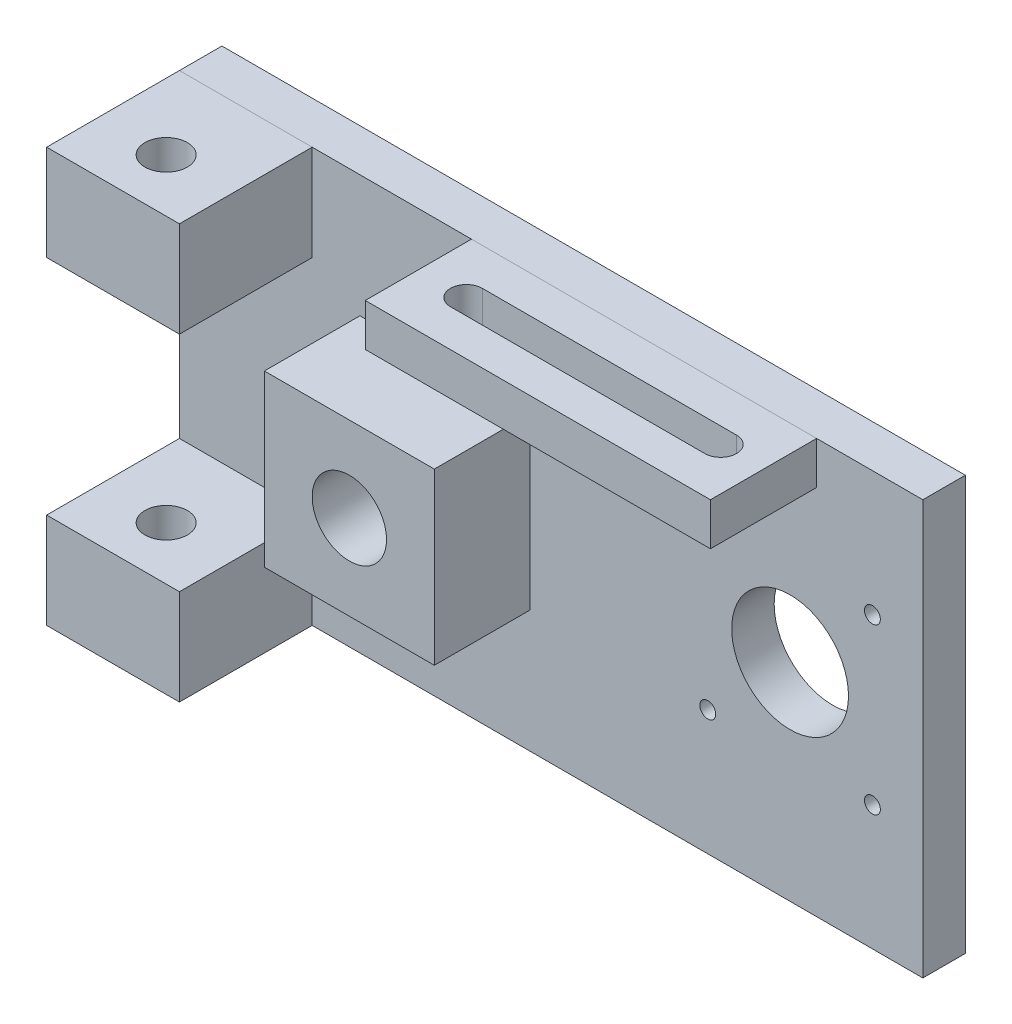
from build123d import *

# Parameters (mm, degrees)
SKETCH1_W             = 140
SKETCH1_H             = 78
BOSS_EXTRUDE1_DEPTH   = 8
CUT_EXTRUDE1_REACH    = 82.529
SKETCH2_R             = 1.5
SKETCH2_R_2           = 11
SKETCH3_W             = 25
SKETCH3_H             = 18
BOSS_EXTRUDE2_DEPTH   = 25
BOSS_EXTRUDE2_2_DEPTH = 25
SKETCH4_R             = 4
CUT_EXTRUDE2_DEPTH    = 110.877204187
BOSS_EXTRUDE4_START   = 8
SKETCH7_W             = 32
SKETCH7_H             = 32
SKETCH7_R             = 11
BOSS_EXTRUDE4_DEPTH   = 8
SKETCH8_W             = 32
SKETCH8_H             = 32
SKETCH8_R             = 7
BOSS_EXTRUDE5_DEPTH   = 10
SKETCH9_W             = 65
SKETCH9_H             = 8
BOSS_EXTRUDE6_DEPTH   = 20
SKETCH11_R            = 3
CUT_EXTRUDE3_DEPTH    = 8


with BuildPart() as part:
    # Sketch1 → Boss-Extrude1 (new body)
    with BuildSketch(Plane.XY):
        Rectangle(SKETCH1_W, SKETCH1_H)
    extrude(amount=BOSS_EXTRUDE1_DEPTH)

    # Sketch2 → Cut-Extrude1 (cut, up to next)
    with BuildSketch(Plane.XY.offset(8), mode=Mode.PRIVATE) as cut_extrude1_sk1:
        with Locations((29.5, 15.5)):
            Circle(SKETCH2_R)
    cut_extrude1_tool1 = extrude(cut_extrude1_sk1.sketch, amount=-CUT_EXTRUDE1_REACH, mode=Mode.PRIVATE) & part.part
    # Sketch2 → Cut-Extrude1 (cut, up to next)
    with BuildSketch(Plane.XY.offset(8), mode=Mode.PRIVATE) as cut_extrude1_sk2:
        with Locations((60.5, 15.5)):
            Circle(SKETCH2_R)
    cut_extrude1_tool2 = extrude(cut_extrude1_sk2.sketch, amount=-CUT_EXTRUDE1_REACH, mode=Mode.PRIVATE) & part.part
    # Sketch2 → Cut-Extrude1 (cut, up to next)
    with BuildSketch(Plane.XY.offset(8), mode=Mode.PRIVATE) as cut_extrude1_sk3:
        with Locations((60.5, -15.5)):
            Circle(SKETCH2_R)
    cut_extrude1_tool3 = extrude(cut_extrude1_sk3.sketch, amount=-CUT_EXTRUDE1_REACH, mode=Mode.PRIVATE) & part.part
    # Sketch2 → Cut-Extrude1 (cut, up to next)
    with BuildSketch(Plane.XY.offset(8), mode=Mode.PRIVATE) as cut_extrude1_sk4:
        with Locations((29.5, -15.5)):
            Circle(SKETCH2_R)
    cut_extrude1_tool4 = extrude(cut_extrude1_sk4.sketch, amount=-CUT_EXTRUDE1_REACH, mode=Mode.PRIVATE) & part.part
    # Sketch2 → Cut-Extrude1 (cut, up to next)
    with BuildSketch(Plane.XY.offset(8), mode=Mode.PRIVATE) as cut_extrude1_sk5:
        with Locations((-20, 0)):
            Circle(SKETCH2_R_2)
    cut_extrude1_tool5 = extrude(cut_extrude1_sk5.sketch, amount=-CUT_EXTRUDE1_REACH, mode=Mode.PRIVATE) & part.part
    # Sketch2 → Cut-Extrude1 (cut, up to next)
    with BuildSketch(Plane.XY.offset(8), mode=Mode.PRIVATE) as cut_extrude1_sk6:
        with Locations((45, 0)):
            Circle(SKETCH2_R_2)
    cut_extrude1_tool6 = extrude(cut_extrude1_sk6.sketch, amount=-CUT_EXTRUDE1_REACH, mode=Mode.PRIVATE) & part.part
    add(cut_extrude1_tool1.solids().sort_by_distance((29.5, 15.5, 8))[0], mode=Mode.SUBTRACT)
    add(cut_extrude1_tool2.solids().sort_by_distance((60.5, 15.5, 8))[0], mode=Mode.SUBTRACT)
    add(cut_extrude1_tool3.solids().sort_by_distance((60.5, -15.5, 8))[0], mode=Mode.SUBTRACT)
    add(cut_extrude1_tool4.solids().sort_by_distance((29.5, -15.5, 8))[0], mode=Mode.SUBTRACT)
    add(cut_extrude1_tool5.solids().sort_by_distance((-20, 0, 8))[0], mode=Mode.SUBTRACT)
    add(cut_extrude1_tool6.solids().sort_by_distance((45, 0, 8))[0], mode=Mode.SUBTRACT)

    # Sketch7 → Boss-Extrude4 (add)
    with BuildSketch(Plane.XY.offset(8).offset(BOSS_EXTRUDE4_START)):
        with Locations((-20, 0)):
            Rectangle(SKETCH7_W, SKETCH7_H)
        with Locations((-20, 0)):
            Circle(SKETCH7_R, mode=Mode.SUBTRACT)
    extrude(amount=-BOSS_EXTRUDE4_DEPTH)

    # Sketch8 → Boss-Extrude5 (add)
    with BuildSketch(Plane.XY.offset(16)):
        with Locations((-20, 0)):
            Rectangle(SKETCH8_W, SKETCH8_H)
        with Locations((-20, 0)):
            Circle(SKETCH8_R, mode=Mode.SUBTRACT)
    extrude(amount=BOSS_EXTRUDE5_DEPTH)


with BuildPart() as body_2:
    # Sketch3 → Boss-Extrude2 (new body)
    with BuildSketch(Plane.XY.offset(8)):
        with Locations((-57.5, 30)):
            Rectangle(SKETCH3_W, SKETCH3_H)
    extrude(amount=BOSS_EXTRUDE2_DEPTH)


with BuildPart() as body_3:
    # Sketch3 → Boss-Extrude2 2 (new body)
    with BuildSketch(Plane.XY.offset(8)):
        with Locations((-57.5, -30)):
            Rectangle(SKETCH3_W, SKETCH3_H)
    extrude(amount=BOSS_EXTRUDE2_2_DEPTH)


with BuildPart() as cut_extrude2_tool:
    # Sketch4 → Cut-Extrude2 (new, through all)
    with BuildSketch(Plane(origin=(0, 39, 0), x_dir=(1, 0, 0), z_dir=(0, 1, 0))):
        with Locations(Location((-57.5, -23, 0), (0, 0, 270))):
            Circle(SKETCH4_R)
    extrude(amount=-CUT_EXTRUDE2_DEPTH)


with BuildPart() as body_2_1:
    add(body_2.part)

    # Cut-Extrude2: cut by cut_extrude2_tool
    add(cut_extrude2_tool.part, mode=Mode.SUBTRACT)


with BuildPart() as body_3_1:
    add(body_3.part)

    # Cut-Extrude2: cut by cut_extrude2_tool
    add(cut_extrude2_tool.part, mode=Mode.SUBTRACT)


with BuildPart() as body_4:
    # Sketch9 → Boss-Extrude6 (new body)
    with BuildSketch(Plane.XY.offset(8)):
        with Locations((17.5, 35)):
            Rectangle(SKETCH9_W, SKETCH9_H)
    extrude(amount=BOSS_EXTRUDE6_DEPTH)

    # Sketch11 → Cut-Extrude3 (cut)
    with BuildSketch(Plane(origin=(0, 39, 0), x_dir=(1, 0, 0), z_dir=(0, 1, 0))):
        with Locations((-5.960232812, -18)):
            Circle(SKETCH11_R)
        with BuildLine():
            Line((41.923671474, -15), (-5.960232812, -15))
            ThreePointArc((-5.960232812, -15), (-3.838912468, -15.878679656), (-2.960232812, -18))
            ThreePointArc((-2.960232812, -18), (-3.838912468, -20.121320344), (-5.960232812, -21))
            Line((-5.960232812, -21), (41.923671474, -21))
            ThreePointArc((41.923671474, -21), (38.923671474, -18), (41.923671474, -15))
        make_face()
        with Locations((41.923671474, -18)):
            Circle(SKETCH11_R)
    extrude(amount=-CUT_EXTRUDE3_DEPTH, mode=Mode.SUBTRACT)


solid = Compound([part.part, body_2_1.part, body_3_1.part, body_4.part])
